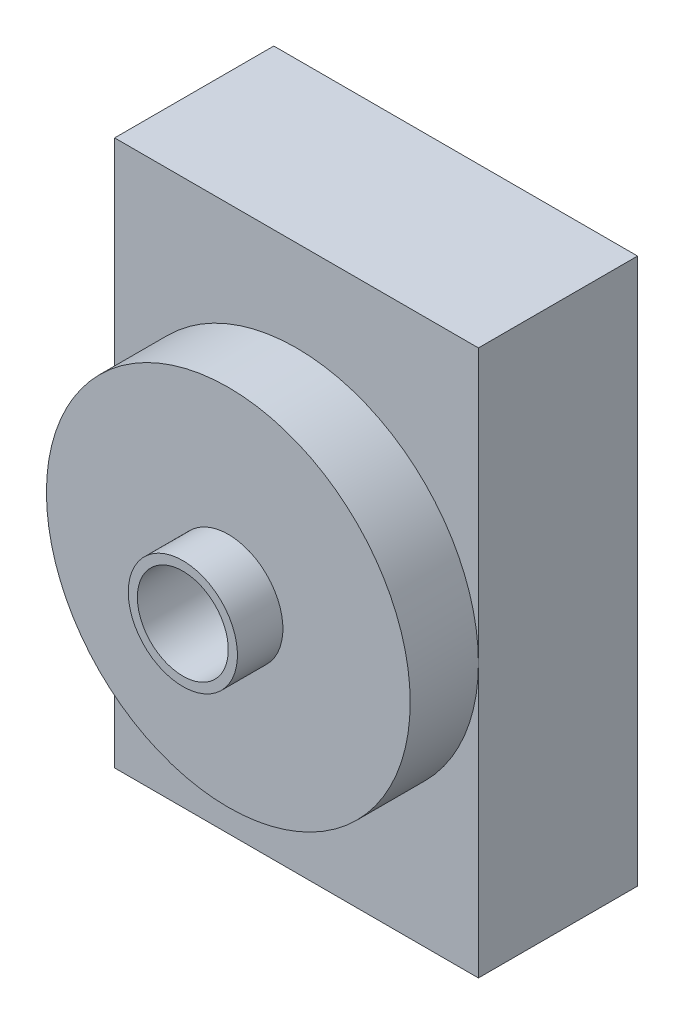
from build123d import *

# Parameters (mm, degrees)
SKETCH1_R           = 25.4
BOSS_EXTRUDE1_DEPTH = 31.75
SKETCH2_R           = 7.62
BOSS_EXTRUDE2_DEPTH = 38.1
SKETCH3_W           = 50.8
SKETCH3_H           = 76.2
BOSS_EXTRUDE3_DEPTH = 22.225
SKETCH4_R           = 6.35
CUT_EXTRUDE1_DEPTH  = 60.56828015


with BuildPart() as part:
    # Sketch1 → Boss-Extrude1 (new body)
    with BuildSketch(Plane.XY):
        Circle(SKETCH1_R)
    extrude(amount=BOSS_EXTRUDE1_DEPTH)

    # Sketch2 → Boss-Extrude2 (add)
    with BuildSketch(Plane.XY):
        with Locations(Location((0, 0, 0), (0, 0, 180))):
            Circle(SKETCH2_R)
    extrude(amount=BOSS_EXTRUDE2_DEPTH)

    # Sketch3 → Boss-Extrude3 (add)
    with BuildSketch(Plane.XY):
        Rectangle(SKETCH3_W, SKETCH3_H)
    extrude(amount=BOSS_EXTRUDE3_DEPTH)

    # Sketch4 → Cut-Extrude1 (cut, through all)
    with BuildSketch(Plane.XY):
        with Locations(Location((0, 0, 0), (0, 0, 180))):
            Circle(SKETCH4_R)
    extrude(amount=CUT_EXTRUDE1_DEPTH, mode=Mode.SUBTRACT)


solid = part.part
